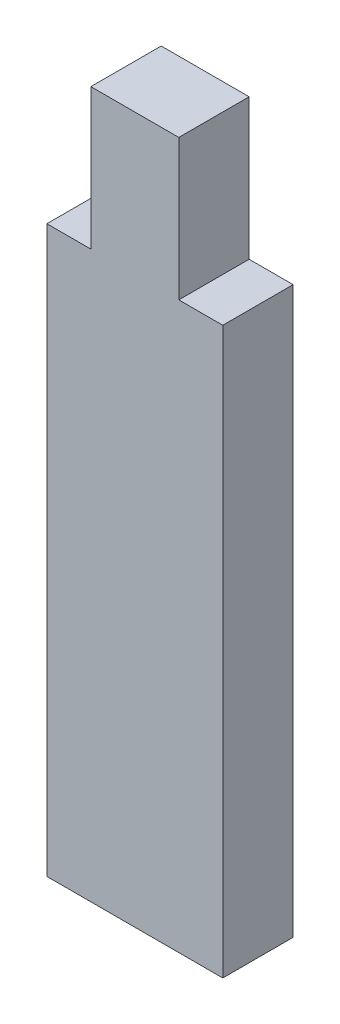
from build123d import *

# Parameters (mm, degrees)
BOSS_EXTRUDE1_DEPTH = 4


with BuildPart() as part:
    # Sketch1 → Boss-Extrude1 (new body)
    with BuildSketch(Plane.XY):
        Polygon((0, 0), (0, 32.14), (2.5, 32.14), (2.5, 40.14), (7.5, 40.14), (7.5, 32.14), (10, 32.14), (10, 0), align=None)
    extrude(amount=BOSS_EXTRUDE1_DEPTH)


solid = part.part
